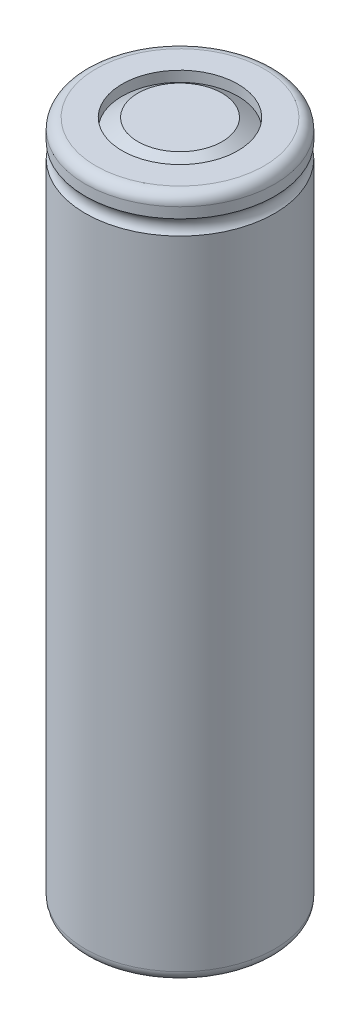
from build123d import *

# Parameters (mm, degrees)
FILLET2_R = 1


with BuildPart() as part:
    # Sketch2 → Revolve1 (revolve)
    with BuildSketch(Plane.XY, mode=Mode.PRIVATE) as revolve1_sk:
        with BuildLine():
            Line((0, 0), (9, 0))
            Line((9, 0), (9, 61.585786438))
            ThreePointArc((9, 61.585786438), (8.707106781, 62.292893219), (9, 63))
            Line((9, 63), (9, 65))
            Line((9, 65), (5.5, 65))
            Line((5.5, 65), (5.5, 64))
            Line((5.5, 64), (4, 65))
            Line((4, 65), (0, 65))
            Line((0, 65), (0, 0))
        make_face()
    revolve(revolve1_sk.sketch.rotate(Axis((0, 0, 0), (0, 1, 0)), 90), axis=Axis((0, 0, 0), (0, 1, 0)))

    # Fillet2
    fillet2_edges = [part.edges().sort_by_distance(p)[0] for p in [
        (0, 0, 9),
        (0, 65, 9),
    ]]
    fillet(fillet2_edges, radius=FILLET2_R)


solid = part.part
